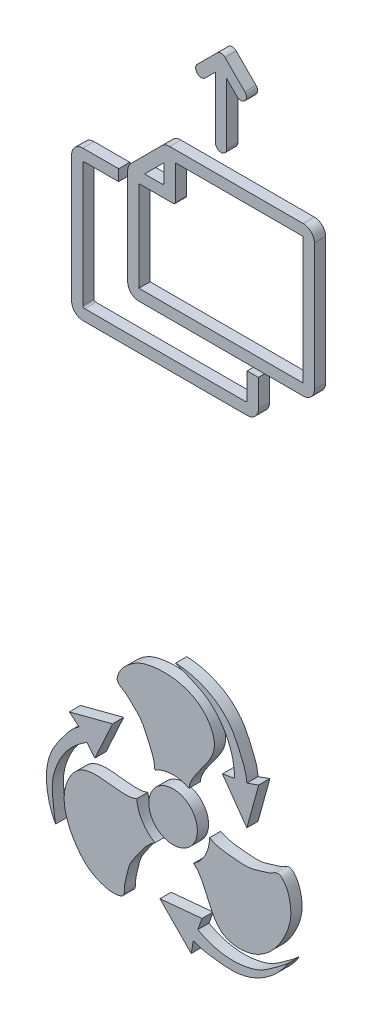
from build123d import *

# Parameters (mm, degrees)
ESQUISSE1_R           = 1.3
BOSS_EXTRU_1_DEPTH    = 0.6
BOSS_EXTRU_1_2_DEPTH  = 0.6
BOSS_EXTRU_1_3_DEPTH  = 0.6
BOSS_EXTRU_1_4_DEPTH  = 0.6
BOSS_EXTRU_1_5_DEPTH  = 0.6
BOSS_EXTRU_1_6_DEPTH  = 0.6
BOSS_EXTRU_1_7_DEPTH  = 0.6
BOSS_EXTRU_1_8_DEPTH  = 0.6
BOSS_EXTRU_1_9_DEPTH  = 0.6
BOSS_EXTRU_1_10_DEPTH = 0.6


with BuildPart() as part:
    # Esquisse1 → Boss.-Extru.1 (new body)
    with BuildSketch(Plane.XY):
        with Locations((76.657913381, -13)):
            Circle(ESQUISSE1_R)
    extrude(amount=BOSS_EXTRU_1_DEPTH)


with BuildPart() as body_2:
    # Esquisse1 → Boss.-Extru.1 2 (new body)
    with BuildSketch(Plane.XY):
        with BuildLine():
            Line((72.039782077, -11.862160948), (72.471384468, -12.37008509))
            Line((72.471384468, -12.37008509), (73.414459548, -10.311380641))
            Line((73.414459548, -10.311380641), (71.100487141, -10.912295078))
            Line((71.100487141, -10.912295078), (71.61724236, -11.349004468))
            add(Edge.make_bspline(
                [(71.61724236, -11.349004468), (71.238645656, -11.59870155), (70.786129059, -12.196309149), (70.167711349, -13.059121094), (69.867288858, -13.974127522), (69.853399509, -15.168202935), (70.106527063, -16.013936188), (70.363018212, -16.484551839)],
                knots=[0, 0, 0, 0, 0.231711357, 0.386988194, 0.549381547, 0.72255086, 1, 1, 1, 1], degree=3))
            add(Edge.make_bspline(
                [(70.363018212, -16.484551839), (70.296109695, -16.174657322), (70.239599274, -15.563952648), (70.132557078, -14.638532612), (70.38071826, -13.775098319), (70.904004622, -12.747348121), (71.549657486, -12.150392803), (72.039782077, -11.862160948)],
                knots=[0, 0, 0, 0, 0.17825737, 0.349465857, 0.520702442, 0.677010219, 1, 1, 1, 1], degree=3))
        make_face()
    extrude(amount=BOSS_EXTRU_1_2_DEPTH)


with BuildPart() as body_3:
    # Esquisse1 → Boss.-Extru.1 3 (new body)
    with BuildSketch(Plane.XY):
        with BuildLine():
            Line((79.952376558, -9.569500499), (79.296700152, -9.689317063))
            Line((79.296700152, -9.689317063), (80.608052964, -11.535396264))
            Line((80.608052964, -11.535396264), (81.244631999, -9.230980158))
            Line((81.244631999, -9.230980158), (80.608052964, -9.46014861))
            add(Edge.make_bspline(
                [(80.608052964, -9.46014861), (80.581107299, -9.007425705), (80.289822236, -8.316731037), (79.851814027, -7.349759618), (79.209606462, -6.632082894), (78.182451495, -6.023016659), (77.323461235, -5.819364924), (76.787650552, -5.80618495)],
                knots=[0, 0, 0, 0, 0.231711357, 0.386988194, 0.549381547, 0.72255086, 1, 1, 1, 1], degree=3))
            add(Edge.make_bspline(
                [(76.787650552, -5.80618495), (77.089481334, -5.903187733), (77.646622307, -6.15960061), (78.501580665, -6.529609367), (79.125256107, -7.176240402), (79.753670706, -8.143294783), (79.947822744, -9.000924225), (79.952376558, -9.569500499)],
                knots=[0, 0, 0, 0, 0.17825737, 0.349465857, 0.520702442, 0.677010219, 1, 1, 1, 1], degree=3))
        make_face()
    extrude(amount=BOSS_EXTRU_1_3_DEPTH)


with BuildPart() as body_4:
    # Esquisse1 → Boss.-Extru.1 4 (new body)
    with BuildSketch(Plane.XY):
        with BuildLine():
            Line((77.981581508, -17.568338554), (78.205655523, -16.940597847))
            Line((78.205655523, -16.940597847), (75.951227631, -17.153223095))
            Line((75.951227631, -17.153223095), (77.628621003, -18.856724764))
            Line((77.628621003, -18.856724764), (77.748444818, -18.190846922))
            add(Edge.make_bspline(
                [(77.748444818, -18.190846922), (78.153987188, -18.393872745), (78.897788848, -18.486959814), (79.954214766, -18.591119288), (80.896844823, -18.393789584), (81.937889139, -17.808780406), (82.543751844, -17.166698887), (82.823071379, -16.709263211)],
                knots=[0, 0, 0, 0, 0.231711357, 0.386988194, 0.549381547, 0.72255086, 1, 1, 1, 1], degree=3))
            add(Edge.make_bspline(
                [(82.823071379, -16.709263211), (82.588149113, -16.922154944), (82.087518562, -17.276446742), (81.339602399, -17.831858021), (80.467765775, -18.04866128), (79.316064815, -18.109357096), (78.476259912, -17.848682973), (77.981581508, -17.568338554)],
                knots=[0, 0, 0, 0, 0.17825737, 0.349465857, 0.520702442, 0.677010219, 1, 1, 1, 1], degree=3))
        make_face()
    extrude(amount=BOSS_EXTRU_1_4_DEPTH)


with BuildPart() as body_5:
    # Esquisse1 → Boss.-Extru.1 5 (new body)
    with BuildSketch(Plane.XY):
        with BuildLine():
            Line((78.376868607, 22.127207794), (78.925396744, 22.675735931))
            Line((78.925396744, 22.675735931), (78.925396744, 19.4))
            ThreePointArc((78.925396744, 19.4), (79.225396744, 19.1), (79.525396744, 19.4))
            Line((79.525396744, 19.4), (79.525396744, 22.675735931))
            Line((79.525396744, 22.675735931), (80.073924882, 22.127207794))
            ThreePointArc((80.073924882, 22.127207794), (80.498188951, 22.127207794), (80.498188951, 22.551471863))
            Line((80.498188951, 22.551471863), (79.437528779, 23.612132034))
            ThreePointArc((79.437528779, 23.612132034), (79.225396744, 23.7), (79.01326471, 23.612132034))
            Line((79.01326471, 23.612132034), (77.952604538, 22.551471863))
            ThreePointArc((77.952604538, 22.551471863), (77.952604538, 22.127207794), (78.376868607, 22.127207794))
        make_face()
    extrude(amount=BOSS_EXTRU_1_5_DEPTH)


with BuildPart() as body_6:
    # Esquisse1 → Boss.-Extru.1 6 (new body)
    with BuildSketch(Plane.XY):
        with BuildLine():
            Line((74.825396744, 10), (83.625396744, 10))
            ThreePointArc((83.625396744, 10), (84.049660813, 10.175735931), (84.225396744, 10.6))
            Line((84.225396744, 10.6), (84.225396744, 17.4))
            ThreePointArc((84.225396744, 17.4), (84.049660813, 17.824264069), (83.625396744, 18))
            Line((83.625396744, 18), (76.473924882, 18))
            ThreePointArc((76.473924882, 18), (76.244314822, 17.95432772), (76.049660813, 17.824264069))
            Line((76.049660813, 17.824264069), (74.401132676, 16.175735931))
            ThreePointArc((74.401132676, 16.175735931), (74.271069025, 15.981081922), (74.225396744, 15.751471863))
            Line((74.225396744, 15.751471863), (74.225396744, 10.6))
            ThreePointArc((74.225396744, 10.6), (74.401132676, 10.175735931), (74.825396744, 10))
        make_face()
        with BuildLine():
            Line((76.673924882, 15.451471863), (74.825396744, 15.451471863))
            Line((74.825396744, 15.451471863), (74.825396744, 10.6))
            Line((74.825396744, 10.6), (83.625396744, 10.6))
            Line((83.625396744, 10.6), (83.625396744, 17.4))
            Line((83.625396744, 17.4), (76.773924882, 17.4))
            Line((76.773924882, 17.4), (76.773924882, 15.551471863))
            ThreePointArc((76.773924882, 15.551471863), (76.74463556, 15.480761184), (76.673924882, 15.451471863))
        make_face(mode=Mode.SUBTRACT)
        with BuildLine():
            Line((75.125396744, 16.051471863), (76.073924882, 16.051471863))
            ThreePointArc((76.073924882, 16.051471863), (76.14463556, 16.080761184), (76.173924882, 16.151471863))
            Line((76.173924882, 16.151471863), (76.173924882, 17.1))
            Line((76.173924882, 17.1), (75.125396744, 16.051471863))
        make_face(mode=Mode.SUBTRACT)
    extrude(amount=BOSS_EXTRU_1_6_DEPTH)


with BuildPart() as body_7:
    # Esquisse1 → Boss.-Extru.1 7 (new body)
    with BuildSketch(Plane.XY):
        with BuildLine():
            Line((71.825396744, 7.6), (80.625396744, 7.6))
            ThreePointArc((80.625396744, 7.6), (81.049660813, 7.775735931), (81.225396744, 8.2))
            Line((81.225396744, 8.2), (81.225396744, 9.664066053))
            Line((81.225396744, 9.664066053), (80.625396744, 9.664066053))
            Line((80.625396744, 9.664066053), (80.625396744, 8.3))
            ThreePointArc((80.625396744, 8.3), (80.596107423, 8.229289322), (80.525396744, 8.2))
            Line((80.525396744, 8.2), (71.925396744, 8.2))
            ThreePointArc((71.925396744, 8.2), (71.854686066, 8.229289322), (71.825396744, 8.3))
            Line((71.825396744, 8.3), (71.825396744, 14.9))
            ThreePointArc((71.825396744, 14.9), (71.854686066, 14.970710678), (71.925396744, 15))
            Line((71.925396744, 15), (73.739413345, 15))
            Line((73.739413345, 15), (73.739413345, 15.6))
            Line((73.739413345, 15.6), (71.825396744, 15.6))
            ThreePointArc((71.825396744, 15.6), (71.401132676, 15.424264069), (71.225396744, 15))
            Line((71.225396744, 15), (71.225396744, 8.2))
            ThreePointArc((71.225396744, 8.2), (71.401132676, 7.775735931), (71.825396744, 7.6))
        make_face()
    extrude(amount=BOSS_EXTRU_1_7_DEPTH)


with BuildPart() as body_8:
    # Esquisse1 → Boss.-Extru.1 8 (new body)
    with BuildSketch(Plane.XY):
        with BuildLine():
            ThreePointArc((74.712686254, -13.135759545), (75.005614678, -14.035494194), (75.687606697, -14.691403018))
            add(Edge.make_bspline(
                [(74.712686254, -13.135759545), (73.94273873, -13.492164455), (72.045837094, -12.572797076), (70.94900239, -14.08861376), (70.757330422, -15.111363014), (70.982280529, -16.110364916), (71.485353996, -16.997593923), (72.104455325, -17.704338728), (72.779681881, -18.018318779), (73.313931429, -18.148314704), (73.685474727, -18.129182574), (73.972975076, -18.041891244), (74.064178203, -17.803672155), (74.033242895, -17.489813977), (74.170086604, -16.99672652), (74.285264509, -16.351261048), (74.872625593, -15.561765078), (75.254015602, -14.95660471), (75.687606697, -14.691403018)],
                knots=[0, 0, 0, 0, 0.218054142, 0.299962889, 0.364831492, 0.441426748, 0.515606834, 0.585451962, 0.640595354, 0.674667588, 0.702894683, 0.722681982, 0.733413152, 0.755077562, 0.790334957, 0.843337153, 0.895223638, 1, 1, 1, 1], degree=3))
        make_face()
    extrude(amount=BOSS_EXTRU_1_8_DEPTH)


with BuildPart() as body_9:
    # Esquisse1 → Boss.-Extru.1 9 (new body)
    with BuildSketch(Plane.XY):
        with BuildLine():
            ThreePointArc((77.748098159, -14.616736335), (78.38082701, -13.913185554), (78.607864704, -12.994608728))
            add(Edge.make_bspline(
                [(77.748098159, -14.616736335), (78.441727628, -15.105327996), (78.59398294, -17.20777669), (80.455136048, -17.399755066), (81.436698867, -17.054373232), (82.189384839, -16.360059774), (82.706210965, -15.480770869), (83.008719255, -14.591240988), (82.943020677, -13.849487611), (82.788475677, -13.321815967), (82.586135117, -13.009616099), (82.366788434, -12.804279157), (82.114883087, -12.844404477), (81.858541586, -13.028124328), (81.363093468, -13.156157929), (80.746515019, -13.379143673), (79.769110911, -13.265222038), (79.054331654, -13.237508786), (78.607864704, -12.994608728)],
                knots=[0, 0, 0, 0, 0.218054142, 0.299962889, 0.364831492, 0.441426748, 0.515606834, 0.585451962, 0.640595354, 0.674667588, 0.702894683, 0.722681982, 0.733413152, 0.755077562, 0.790334957, 0.843337153, 0.895223638, 1, 1, 1, 1], degree=3))
        make_face()
    extrude(amount=BOSS_EXTRU_1_9_DEPTH)


with BuildPart() as body_10:
    # Esquisse1 → Boss.-Extru.1 10 (new body)
    with BuildSketch(Plane.XY):
        with BuildLine():
            ThreePointArc((77.512955729, -11.247504119), (76.587298455, -11.051320252), (75.678268741, -11.313988254))
            add(Edge.make_bspline(
                [(77.512955729, -11.247504119), (77.589273785, -10.402507549), (79.333920109, -9.219426233), (78.569601705, -7.511631174), (77.779710853, -6.834263754), (76.802074775, -6.52957531), (75.782175182, -6.521635208), (74.860565563, -6.704420285), (74.251037584, -7.13219361), (73.871333036, -7.529869328), (73.702130298, -7.861201327), (73.633976632, -8.153829599), (73.794678852, -8.351923368), (74.081955661, -8.482061694), (74.440560071, -8.847115551), (74.941960614, -9.269595278), (75.332003639, -10.173012884), (75.665392887, -10.805886504), (75.678268741, -11.313988254)],
                knots=[0, 0, 0, 0, 0.218054142, 0.299962889, 0.364831492, 0.441426748, 0.515606834, 0.585451962, 0.640595354, 0.674667588, 0.702894683, 0.722681982, 0.733413152, 0.755077562, 0.790334957, 0.843337153, 0.895223638, 1, 1, 1, 1], degree=3))
        make_face()
    extrude(amount=BOSS_EXTRU_1_10_DEPTH)


solid = Compound([part.part, body_2.part, body_3.part, body_4.part, body_5.part, body_6.part, body_7.part, body_8.part, body_9.part, body_10.part])
